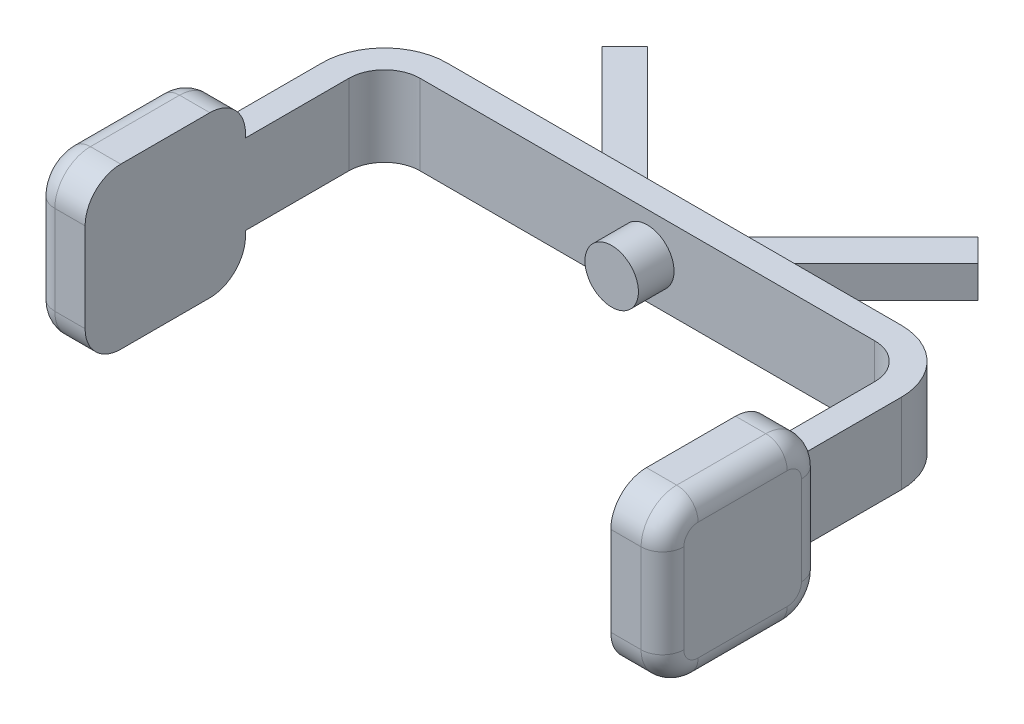
from build123d import *

# Parameters (mm, degrees)
EXTRUDE_2_DEPTH        = 2.25
EXTRUDE_4_DEPTH        = 0.9
EXTRUDE_5_DEPTH        = 2.9
FILLET_1_R             = 1.2
FILLET_1_OF_MIRROR_2_R = 1.2
SKETCH_3_R             = 1.5
EXTRUDE_6_DEPTH        = 2


with BuildPart() as part:
    # 草图1 → 凸台-拉伸2 (new, symmetric)
    with BuildSketch(Plane(origin=(0, 0, 0), x_dir=(1, 0, 0), z_dir=(0, 1, 0))):
        with BuildLine():
            Line((-12.75, -1.5), (12.75, -1.5))
            ThreePointArc((12.75, -1.5), (14.164213562, -2.085786438), (14.75, -3.5))
            Line((14.75, -3.5), (14.75, -9.3))
            Line((14.75, -9.3), (16.25, -9.3))
            Line((16.25, -9.3), (16.25, -3.5))
            ThreePointArc((16.25, -3.5), (15.224873734, -1.025126266), (12.75, 0))
            Line((12.75, 0), (-12.75, 0))
            ThreePointArc((-12.75, 0), (-15.224873734, -1.025126266), (-16.25, -3.5))
            Line((-16.25, -3.5), (-16.25, -9.3))
            Line((-16.25, -9.3), (-14.75, -9.3))
            Line((-14.75, -9.3), (-14.75, -3.5))
            ThreePointArc((-14.75, -3.5), (-14.164213562, -2.085786438), (-12.75, -1.5))
        make_face()
    extrude(amount=EXTRUDE_2_DEPTH, both=True)

    # 草图1<6> → 凸台-拉伸4 (add, symmetric)
    with BuildSketch(Plane(origin=(0, 0, 0), x_dir=(1, 0, 0), z_dir=(0, 1, 0))):
        Polygon((-4.045584412, 0), (-1.5, 0), (-9.278174593, 7.778174593), (-10.550966799, 6.505382387), align=None)
        Polygon((9.278174593, 7.778174593), (1.5, 0), (4.045584412, 0), (10.550966799, 6.505382387), align=None)
    extrude(amount=EXTRUDE_4_DEPTH, both=True)

    # 草图2 → 凸台-拉伸5 (add)
    with BuildSketch(Plane.ZY.offset(-14.75)):
        with BuildLine():
            Line((16.3, 4.478921871), (11.3, 4.478921871))
            ThreePointArc((11.3, 4.478921871), (9.885786438, 3.893135433), (9.3, 2.478921871))
            Line((9.3, 2.478921871), (9.3, -2.521078129))
            ThreePointArc((9.3, -2.521078129), (9.885786438, -3.935291691), (11.3, -4.521078129))
            Line((11.3, -4.521078129), (16.3, -4.521078129))
            ThreePointArc((16.3, -4.521078129), (17.714213562, -3.935291691), (18.3, -2.521078129))
            Line((18.3, -2.521078129), (18.3, 2.478921871))
            ThreePointArc((18.3, 2.478921871), (17.714213562, 3.893135433), (16.3, 4.478921871))
        make_face()
    extrude_5 = extrude(amount=-EXTRUDE_5_DEPTH)

    # 圆角1
    fillet_1_edges = [part.edges().sort_by_distance(p)[0] for p in [
        (17.65, -0.021078129, 9.3),
        (17.65, -3.935291691, 9.885786438),
        (17.65, -4.521078129, 13.8),
        (17.65, -3.935291691, 17.714213562),
        (17.65, -0.021078129, 18.3),
        (17.65, 3.893135433, 17.714213562),
        (17.65, 4.478921871, 13.8),
        (17.65, 3.893135433, 9.885786438),
    ]]
    fillet(fillet_1_edges, radius=FILLET_1_R)

    # 镜向2: 凸台-拉伸5 across plane
    add(extrude_5.mirror(Plane(origin=(0, 0, 0), x_dir=(0, 0, 1), z_dir=(1, 0, 0))))

    # 圆角1 of 镜向2
    fillet_1_of_mirror_2_edges = [part.edges().sort_by_distance(p)[0] for p in [
        (-17.65, -0.021078129, 9.3),
        (-17.65, -3.935291691, 9.885786438),
        (-17.65, -4.521078129, 13.8),
        (-17.65, -3.935291691, 17.714213562),
        (-17.65, -0.021078129, 18.3),
        (-17.65, 3.893135433, 17.714213562),
        (-17.65, 4.478921871, 13.8),
        (-17.65, 3.893135433, 9.885786438),
    ]]
    fillet(fillet_1_of_mirror_2_edges, radius=FILLET_1_OF_MIRROR_2_R)

    # 草图3 → 凸台-拉伸6 (add)
    with BuildSketch(Plane.XY.offset(1.5)):
        Circle(SKETCH_3_R)
    extrude(amount=EXTRUDE_6_DEPTH)


solid = part.part
